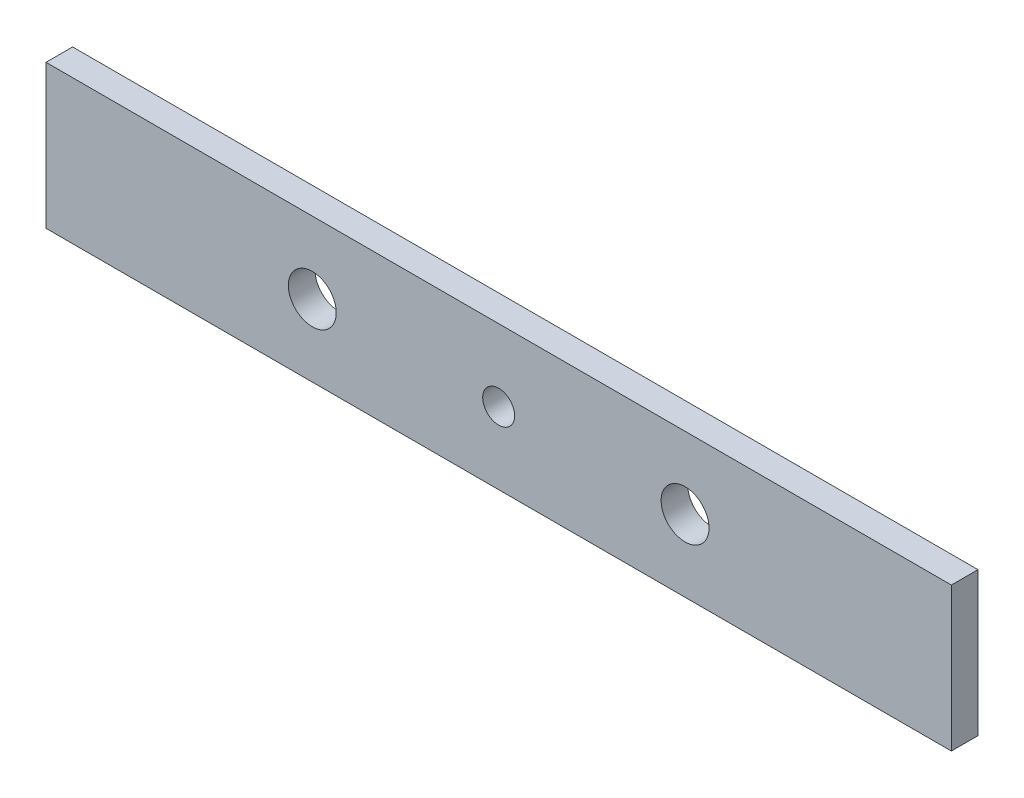
from build123d import *

# Parameters (mm, degrees)
SKETCH1_W           = 170
SKETCH1_H           = 5
BOSS_EXTRUDE1_DEPTH = 27
SKETCH2_R           = 3
SKETCH2_R_2         = 4.5
CUT_EXTRUDE1_DEPTH  = 29


with BuildPart() as part:
    # Sketch1 → Boss-Extrude1 (new body)
    with BuildSketch(Plane(origin=(0, 0, 0), x_dir=(1, 0, 0), z_dir=(0, 1, 0))):
        with Locations((85, 2.5)):
            Rectangle(SKETCH1_W, SKETCH1_H)
    extrude(amount=BOSS_EXTRUDE1_DEPTH)

    # Sketch2 → Cut-Extrude1 (cut)
    with BuildSketch(Plane.XY):
        with Locations((85, 13.5)):
            Circle(SKETCH2_R)
        with Locations((120, 13.5)):
            Circle(SKETCH2_R_2)
        with Locations((50, 13.5)):
            Circle(SKETCH2_R_2)
    extrude(amount=-CUT_EXTRUDE1_DEPTH, mode=Mode.SUBTRACT)


solid = part.part
